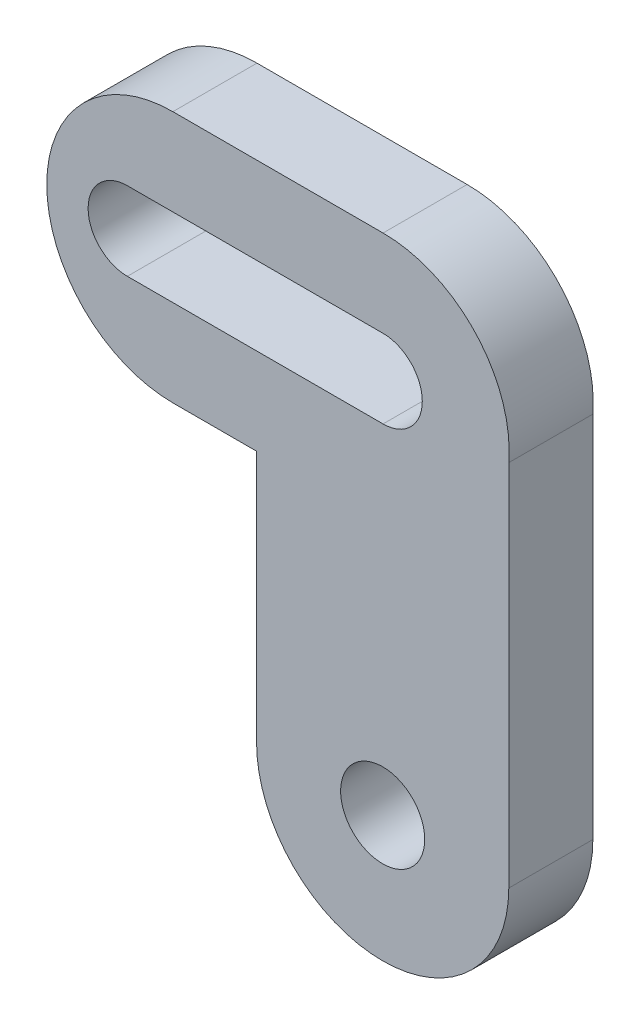
from build123d import *

# Parameters (mm, degrees)
MODEL_R                 = 1.5
SALIENTE_EXTRUIR1_DEPTH = 3


with BuildPart() as part:
    # Model → Saliente-Extruir1 (new body)
    with BuildSketch(Plane.XY):
        with BuildLine():
            Line((185.340992888, 207.251228653), (185.340992888, 220.397042101))
            ThreePointArc((185.340992888, 220.397042101), (184.159786007, 223.805419259), (180.854953221, 225.251228653))
            Line((180.854953221, 225.251228653), (173.354953221, 225.251228653))
            ThreePointArc((173.354953221, 225.251228653), (168.854953221, 220.751228653), (173.354953221, 216.251228653))
            Line((173.354953221, 216.251228653), (176.340992888, 216.251228653))
            Line((176.340992888, 216.251228653), (176.340992888, 207.251228653))
            ThreePointArc((176.340992888, 207.251228653), (180.840992888, 202.751228653), (185.340992888, 207.251228653))
        make_face()
        with Locations((180.840992888, 207.251228653)):
            Circle(MODEL_R, mode=Mode.SUBTRACT)
        with BuildLine():
            ThreePointArc((171.729953221, 219.351228653), (170.329953221, 220.751228653), (171.729953221, 222.151228653))
            Line((171.729953221, 222.151228653), (180.854953221, 222.151228653))
            ThreePointArc((180.854953221, 222.151228653), (182.254953221, 220.751228653), (180.854953221, 219.351228653))
            Line((180.854953221, 219.351228653), (171.729953221, 219.351228653))
        make_face(mode=Mode.SUBTRACT)
    extrude(amount=SALIENTE_EXTRUIR1_DEPTH)


solid = part.part
